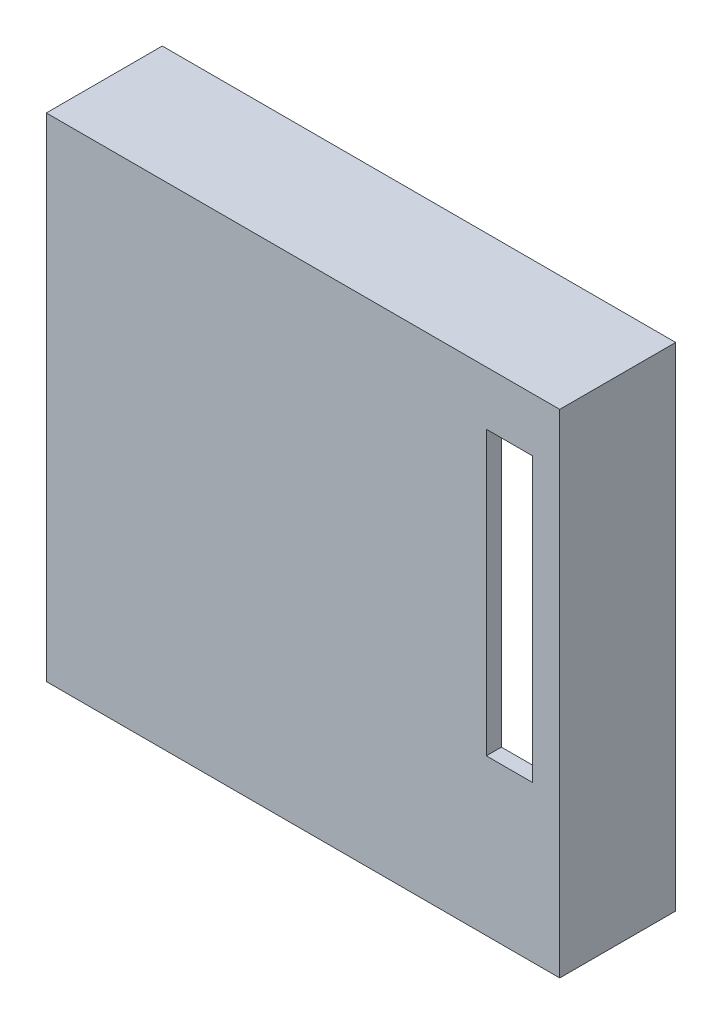
from build123d import *

# Parameters (mm, degrees)
BOSS_EXTRUDE1_DEPTH      = 1
BOSS_EXTRUDE1_DEPTH_BACK = 95
SKETCH3_W                = 102.168296719
SKETCH3_H                = 23.073037812
BOSS_EXTRUDE2_DEPTH      = 2
CUT_EXTRUDE1_DEPTH       = 7
SKETCH5_W                = 9.153790551
SKETCH5_H                = 56.288421304
CUT_EXTRUDE2_DEPTH       = 12


with BuildPart() as part:
    # Sketch1 → Boss-Extrude1 (new, two sides: drawn at the far end of the back side and taken through both)
    with BuildSketch(Plane(origin=(1.86e-07, 2.18892535, 0), x_dir=(0.9999999999999963, -8.499370700000005e-08, 0), z_dir=(-8.499370700000005e-08, -0.9999999999999964, 0)).offset(-BOSS_EXTRUDE1_DEPTH_BACK)):
        Polygon((-10.086587255, 78.390258261), (-12.920734899, 78.390258261), (-12.920734899, 101.463296073), (89.24756182, 101.463296073), (89.24756182, 78.390258261), (86.413414176, 78.390258261), (86.413414176, 79.890257832), (88.421490182, 79.890257832), (88.421490182, 81.69025819), (86.24756182, 81.69025819), (86.24756182, 98.463296073), (-9.920734899, 98.463296073), (-9.920734899, 81.69025819), (-12.094663261, 81.69025819), (-12.094663261, 79.890257832), (-10.086587255, 79.890257832), align=None)
    extrude(amount=BOSS_EXTRUDE1_DEPTH + BOSS_EXTRUDE1_DEPTH_BACK)

    # Sketch3 → Boss-Extrude2 (add)
    with BuildSketch(Plane(origin=(8.26e-06, 97.18892535, 0), x_dir=(0.9999999999999963, -8.499370702344177e-08, 0), z_dir=(8.499370702344177e-08, 0.9999999999999964, 0))):
        with Locations((38.163413461, -89.926777167)):
            Rectangle(SKETCH3_W, SKETCH3_H)
    extrude(amount=BOSS_EXTRUDE2_DEPTH)

    # Sketch4 → Cut-Extrude1 (cut)
    with BuildSketch(Plane(origin=(-12.920734899, 1.098e-06, 0), x_dir=(0, 0, 1), z_dir=(-0.9999999999999964, 8.499370700000005e-08, 0))):
        Polygon((78.390258261, 11.48892535), (82.313500316, 11.48892535), (82.313500316, 82.388929164), (78.390258261, 82.388929164), (75.766454091, 82.388929164), (75.766454091, 11.48892535), align=None)
    extrude(amount=-CUT_EXTRUDE1_DEPTH, mode=Mode.SUBTRACT)

    # Sketch5 → Cut-Extrude2 (cut)
    with BuildSketch(Plane.XY.offset(101.463296073)):
        with Locations((79.217116041, 60.318884388)):
            Rectangle(SKETCH5_W, SKETCH5_H)
    extrude(amount=-CUT_EXTRUDE2_DEPTH, mode=Mode.SUBTRACT)


solid = part.part
